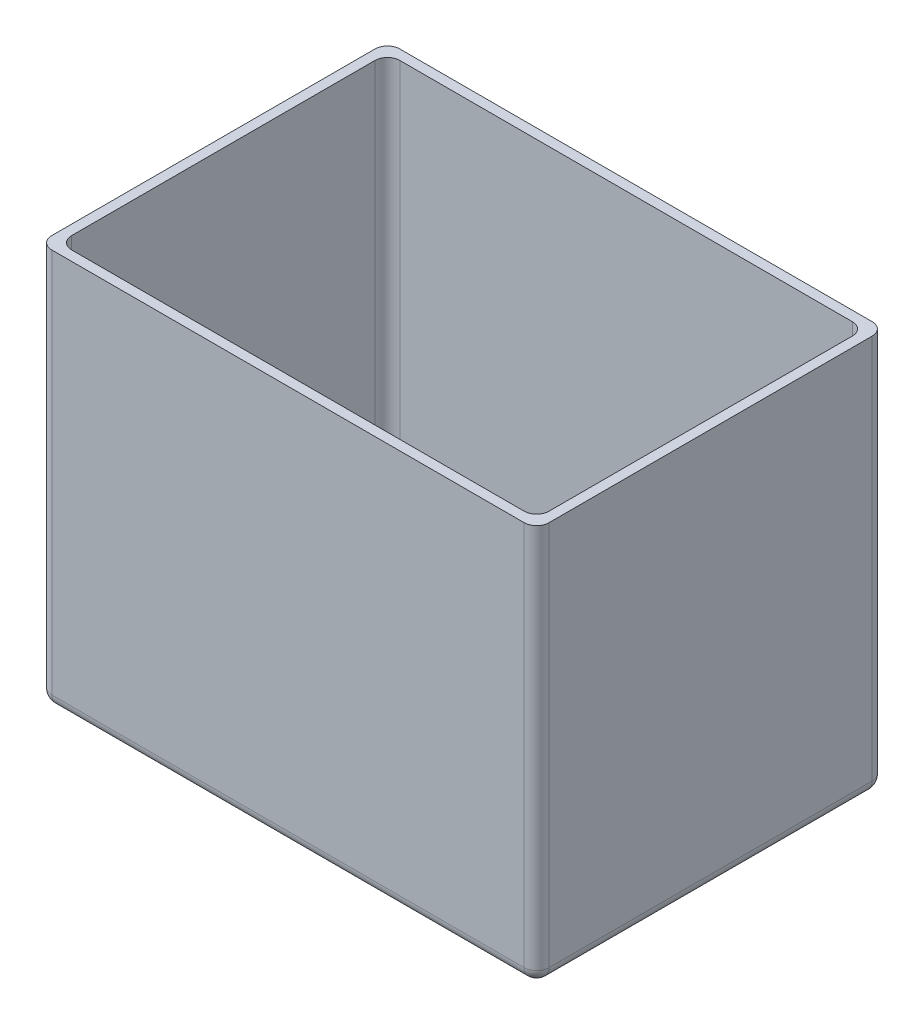
from build123d import *

# Parameters (mm, degrees)
SKETCH_2_W          = 100
SKETCH_2_H          = 70
EXTRUDE_1_DEPTH     = 80
SKETCH_4_W          = 96
SKETCH_4_H          = 66
CUT_EXTRUDE_1_DEPTH = 78
FILLET_2_R          = 2.5
SKETCH_6_R          = 5
SKETCH_6_R_2        = 2.3
EXTRUDE_3_DEPTH     = 10


with BuildPart() as part:
    # Эскиз2 → Бобышка-Вытянуть1 (new body)
    with BuildSketch(Plane(origin=(0, 0, 0), x_dir=(1, 0, 0), z_dir=(0, 1, 0))):
        Rectangle(SKETCH_2_W, SKETCH_2_H)
    extrude(amount=EXTRUDE_1_DEPTH)

    # Эскиз4 → Вырез-Вытянуть1 (cut)
    with BuildSketch(Plane(origin=(0, 80, 0), x_dir=(1, 0, 0), z_dir=(0, 1, 0))):
        Rectangle(SKETCH_4_W, SKETCH_4_H)
    extrude(amount=-CUT_EXTRUDE_1_DEPTH, mode=Mode.SUBTRACT)

    # Скругление2
    fillet_2_edges = [part.edges().sort_by_distance(p)[0] for p in [
        (-48, 2, 0),
        (-48, 41, 33),
        (0, 2, -33),
        (-48, 41, -33),
        (48, 2, 0),
        (48, 41, -33),
        (0, 2, 33),
        (48, 41, 33),
        (0, 0, 35),
        (-50, 0, 0),
        (0, 0, -35),
        (50, 0, 0),
        (50, 40, 35),
        (-50, 40, 35),
        (-50, 40, -35),
        (50, 40, -35),
    ]]
    fillet(fillet_2_edges, radius=FILLET_2_R)

    # Эскиз6 → Бобышка-Вытянуть3 (add)
    # profile 1 of 4: a face of its own
    with BuildSketch(Plane(origin=(0, 2, 0), x_dir=(1, 0, 0), z_dir=(0, 1, 0))):
        with Locations(Location((-37.5, 13.725, 0), (0, 0, 270))):
            Circle(SKETCH_6_R)
        with Locations(Location((-37.5, 13.725, 0), (0, 0, 270))):
            Circle(SKETCH_6_R_2, mode=Mode.SUBTRACT)
    # profile 2 of 4: a face of its own
    with BuildSketch(Plane(origin=(0, 2, 0), x_dir=(1, 0, 0), z_dir=(0, 1, 0))):
        with Locations(Location((37.5, 13.725, 0), (0, 0, 270))):
            Circle(SKETCH_6_R)
        with Locations(Location((37.5, 13.725, 0), (0, 0, 270))):
            Circle(SKETCH_6_R_2, mode=Mode.SUBTRACT)
    # profile 3 of 4: a face of its own
    with BuildSketch(Plane(origin=(0, 2, 0), x_dir=(1, 0, 0), z_dir=(0, 1, 0))):
        with Locations(Location((-37.5, -13.725, 0), (0, 0, 270))):
            Circle(SKETCH_6_R)
        with Locations(Location((-37.5, -13.725, 0), (0, 0, 270))):
            Circle(SKETCH_6_R_2, mode=Mode.SUBTRACT)
    # profile 4 of 4: a face of its own
    with BuildSketch(Plane(origin=(0, 2, 0), x_dir=(1, 0, 0), z_dir=(0, 1, 0))):
        with Locations(Location((37.5, -13.725, 0), (0, 0, 270))):
            Circle(SKETCH_6_R)
        with Locations(Location((37.5, -13.725, 0), (0, 0, 270))):
            Circle(SKETCH_6_R_2, mode=Mode.SUBTRACT)
    extrude(amount=EXTRUDE_3_DEPTH)


solid = part.part
